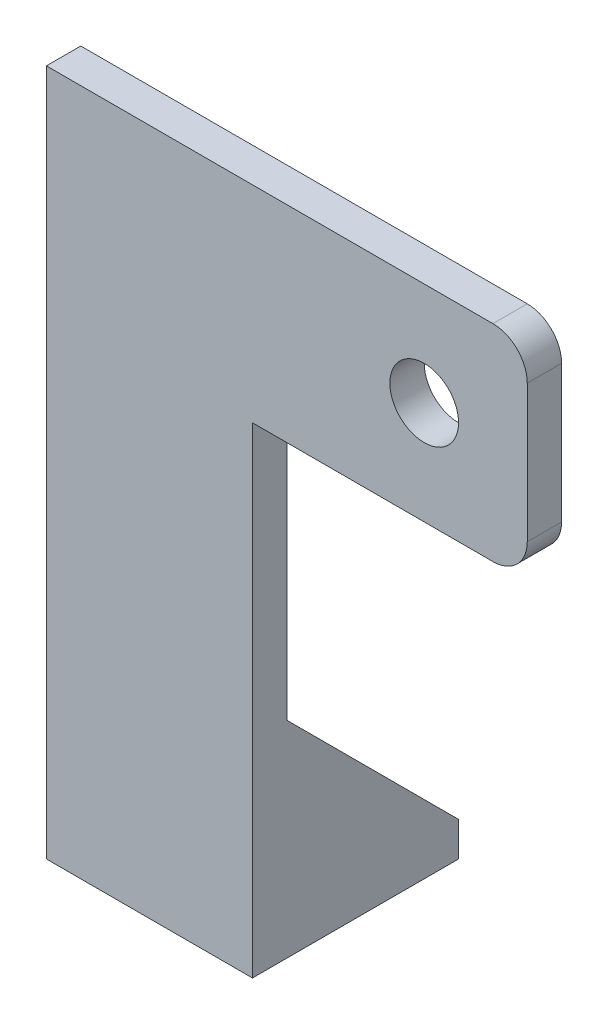
from build123d import *

# Parameters (mm, degrees)
BOSS_EXTRUDE1_DEPTH = 5
SKETCH4_R           = 5
CUT_EXTRUDE1_DEPTH  = 5
SKETCH5_W           = 30
SKETCH5_H           = 30
BOSS_EXTRUDE4_DEPTH = 5
BOSS_EXTRUDE5_DEPTH = 5
SKETCH9_R           = 5
CUT_EXTRUDE4_DEPTH  = 10
SKETCH10_W          = 45.027348062
SKETCH10_H          = 31.505755331
CUT_EXTRUDE5_DEPTH  = 10


with BuildPart() as part:
    # Sketch1 → Boss-Extrude1 (new body)
    with BuildSketch(Plane.XY):
        with BuildLine():
            Line((5, 0), (70, 0))
            Line((70, 0), (70, -30))
            Line((70, -30), (70, -95))
            Line((70, -95), (40, -95))
            Line((40, -95), (40, -30))
            Line((40, -30), (5, -30))
            ThreePointArc((5, -30), (1.464466094, -28.535533906), (0, -25))
            Line((0, -25), (0, -5))
            ThreePointArc((0, -5), (1.464466094, -1.464466094), (5, 0))
        make_face()
    boss_extrude1 = extrude(amount=BOSS_EXTRUDE1_DEPTH)

    # Sketch4 → Cut-Extrude1 (cut)
    with BuildSketch(Plane.XY.offset(5)):
        with Locations((15, -15)):
            Circle(SKETCH4_R)
    extrude(amount=-CUT_EXTRUDE1_DEPTH, mode=Mode.SUBTRACT)

    # Sketch5 → Boss-Extrude4 (add)
    with BuildSketch(Plane.XZ.offset(95)):
        with Locations((55, -10)):
            Rectangle(SKETCH5_W, SKETCH5_H)
    extrude(amount=BOSS_EXTRUDE4_DEPTH)

    # Sketch6 → Boss-Extrude5 (add)
    with BuildSketch(Plane(origin=(70, 0, 0), x_dir=(0, 0, -1), z_dir=(1, 0, 0))):
        Polygon((0, -70), (25, -95), (0, -95), align=None)
    boss_extrude5 = extrude(amount=-BOSS_EXTRUDE5_DEPTH)

    # Mirror2: Boss-Extrude5 across plane
    add(boss_extrude5.mirror(Plane.ZY.offset(-55)))

    # Mirror4: Boss-Extrude1 across plane
    add(boss_extrude1.mirror(Plane.ZY.offset(-55)))

    # Sketch9 → Cut-Extrude4 (cut)
    with BuildSketch(Plane(origin=(0, 0, 0), x_dir=(-1, 0, 0), z_dir=(0, 0, -1))):
        with Locations((-95, -15)):
            Circle(SKETCH9_R)
    extrude(amount=-CUT_EXTRUDE4_DEPTH, mode=Mode.SUBTRACT)

    # Sketch10 → Cut-Extrude5 (cut)
    with BuildSketch(Plane(origin=(0, 0, 0), x_dir=(-1, 0, 0), z_dir=(0, 0, -1))):
        with Locations((-17.486325969, -14.247122335)):
            Rectangle(SKETCH10_W, SKETCH10_H)
    extrude(amount=-CUT_EXTRUDE5_DEPTH, mode=Mode.SUBTRACT)


solid = part.part
